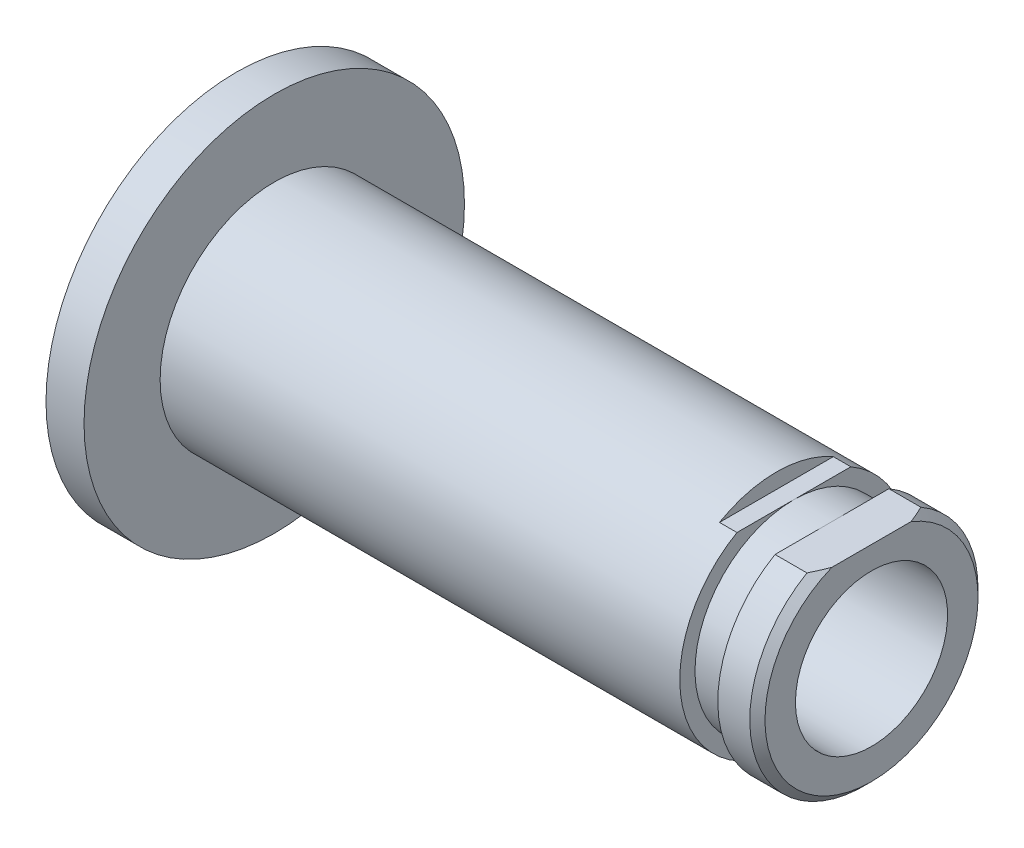
from build123d import *

# Parameters (mm, degrees)
SKETCH2_W          = 162.317604445
SKETCH2_H          = 55.549243825
CUT_EXTRUDE1_DEPTH = 15.875
SKETCH3_W          = 6.35
SKETCH3_H          = 3.175
CHAMFER1_SIZE      = 1.27


with BuildPart() as part:
    # Sketch1 → Revolve1 (revolve)
    with BuildSketch(Plane.XY, mode=Mode.PRIVATE) as revolve1_sk:
        Polygon((0, 31.75), (0, 6.477), (44.45, 6.477), (44.45, 12.7), (106.045, 12.7), (106.045, 19.05), (6.35, 19.05), (6.35, 31.75), align=None)
    revolve(revolve1_sk.sketch.rotate(Axis((0, 0, 0), (1, 0, 0)), 90), axis=Axis((0, 0, 0), (1, 0, 0)))

    # Sketch2 → Cut-Extrude1 (cut)
    with BuildSketch(Plane(origin=(106.045, 0, 0), x_dir=(0, 0, -1), z_dir=(1, 0, 0))):
        with Locations((1.710934167, 44.284621913)):
            Rectangle(SKETCH2_W, SKETCH2_H)
    extrude(amount=-CUT_EXTRUDE1_DEPTH, mode=Mode.SUBTRACT)

    # Sketch3 → Cut-Revolve1 (revolve, cut)
    with BuildSketch(Plane.XY, mode=Mode.PRIVATE) as cut_revolve1_sk:
        with Locations((96.266, 18.0975)):
            Rectangle(SKETCH3_W, SKETCH3_H)
    revolve(cut_revolve1_sk.sketch.rotate(Axis((0, 0, 0), (1, 0, 0)), 90), axis=Axis((0, 0, 0), (1, 0, 0)), mode=Mode.SUBTRACT)

    # Chamfer1
    chamfer1_edges = [part.edges().sort_by_distance(p)[0] for p in [
        (106.045, -19.05, 0),
    ]]
    chamfer(chamfer1_edges, length=CHAMFER1_SIZE)


solid = part.part
